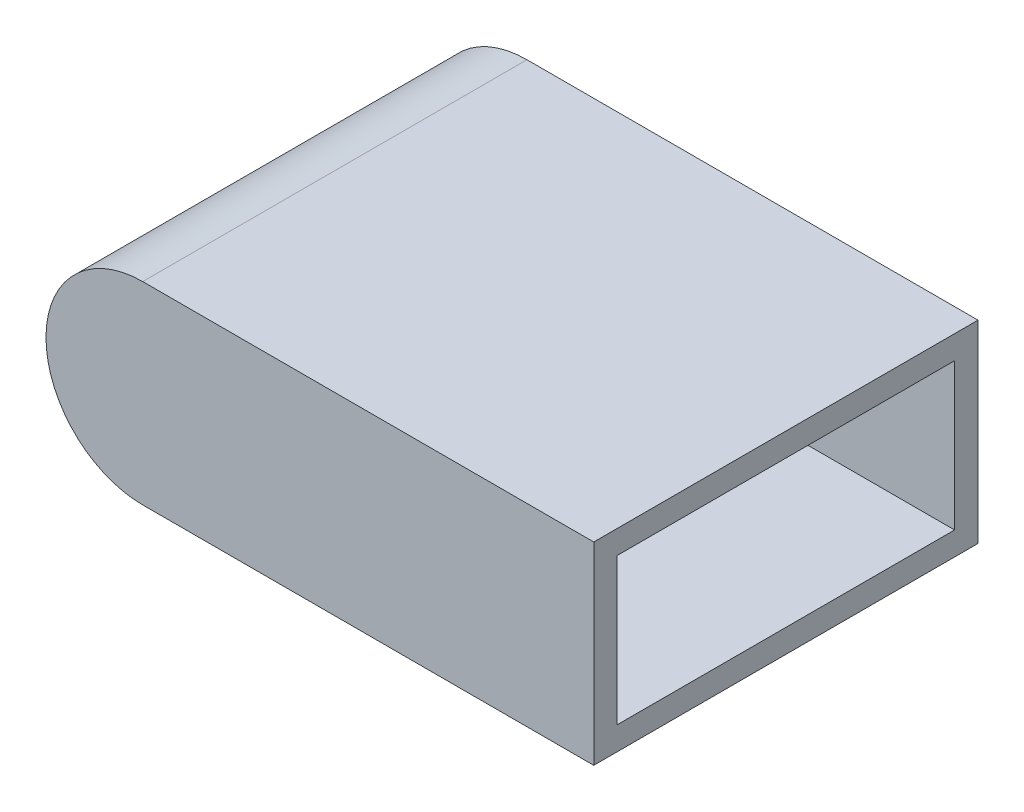
from build123d import *

# Parameters (mm, degrees)
ESQUISSE1_W             = 52
ESQUISSE1_H             = 44.3
BOSS_EXTRU_1_DEPTH      = 22.3
ESQUISSE4_W             = 38.9
ESQUISSE4_H             = 16.9
ENL_V_MAT_EXTRU_2_DEPTH = 52
BOSS_EXTRU_3_DEPTH      = 44.3
ENL_V_MAT_EXTRU_4_DEPTH = 38.9


with BuildPart() as part:
    # Esquisse1 → Boss.-Extru.1 (new body)
    with BuildSketch(Plane(origin=(0, 0, 0), x_dir=(1, 0, 0), z_dir=(0, 1, 0))):
        with Locations((-7.759163987, 0)):
            Rectangle(ESQUISSE1_W, ESQUISSE1_H)
    extrude(amount=BOSS_EXTRU_1_DEPTH)

    # Esquisse4 → Enlèv. mat.-Extru.2 (cut)
    with BuildSketch(Plane(origin=(18.240836013, 0, 0), x_dir=(0, 0, -1), z_dir=(1, 0, 0))):
        with Locations((0, 11.15)):
            Rectangle(ESQUISSE4_W, ESQUISSE4_H)
    extrude(amount=-ENL_V_MAT_EXTRU_2_DEPTH, mode=Mode.SUBTRACT)

    # Esquisse5 → Boss.-Extru.3 (add)
    with BuildSketch(Plane.XY.offset(22.15)):
        with BuildLine():
            Line((-33.759163987, 22.3), (-33.759163987, 0))
            ThreePointArc((-33.759163987, 0), (-44.909163987, 11.15), (-33.759163987, 22.3))
        make_face()
    extrude(amount=-BOSS_EXTRU_3_DEPTH)

    # Esquisse8 → Enlèv. mat.-Extru.4 (cut)
    with BuildSketch(Plane(origin=(0, 0, 19.45), x_dir=(-1, 0, 0), z_dir=(0, 0, -1))):
        with BuildLine():
            Line((33.759163987, 2.700004998), (33.759163987, 19.599995002))
            ThreePointArc((33.759163987, 19.599995002), (42.209158989, 11.15), (33.759163987, 2.700004998))
        make_face()
    extrude(amount=ENL_V_MAT_EXTRU_4_DEPTH, mode=Mode.SUBTRACT)


solid = part.part
